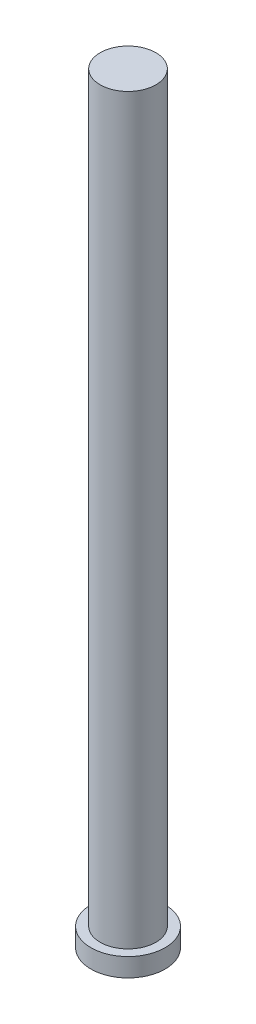
from build123d import *

# Parameters (mm, degrees)
SKETCH1_R           = 1.5
BOSS_EXTRUDE1_DEPTH = 40
SKETCH2_R           = 2
BOSS_EXTRUDE2_DEPTH = 1


with BuildPart() as part:
    # Sketch1 → Boss-Extrude1 (new body)
    with BuildSketch(Plane(origin=(0, 0, 0), x_dir=(1, 0, 0), z_dir=(0, 1, 0))):
        with Locations(Location((0, 0, 0), (0, 0, 270))):
            Circle(SKETCH1_R)
    extrude(amount=BOSS_EXTRUDE1_DEPTH)

    # Sketch2 → Boss-Extrude2 (add)
    with BuildSketch(Plane.XZ):
        with Locations(Location((0, 0, 0), (0, 0, 270))):
            Circle(SKETCH2_R)
    extrude(amount=BOSS_EXTRUDE2_DEPTH)


solid = part.part
